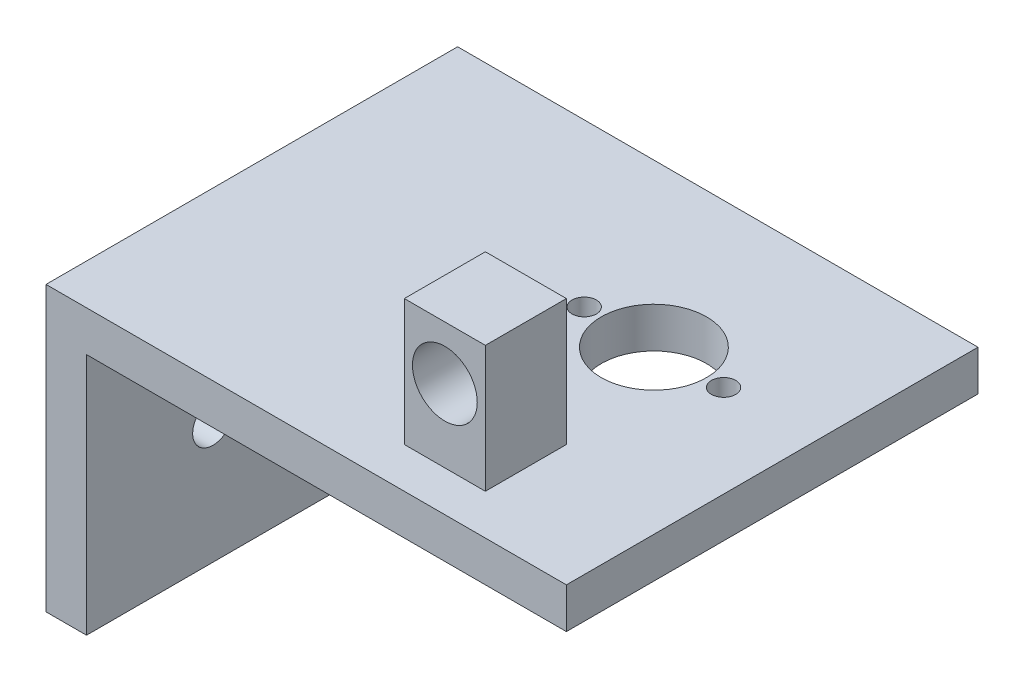
from build123d import *

# Parameters (mm, degrees)
SKETCH3_W           = 40
SKETCH3_H           = 50.8
BOSS_EXTRUDE1_DEPTH = 5
SKETCH4_W           = 10
SKETCH4_H           = 10
BOSS_EXTRUDE2_DEPTH = 15.6
SKETCH5_R           = 4
CUT_EXTRUDE4_DEPTH  = 8
SKETCH6_W           = 50.8
SKETCH6_H           = 5
BOSS_EXTRUDE3_DEPTH = 24.225
SKETCH8_W           = 5
SKETCH8_H           = 50.8
BOSS_EXTRUDE4_DEPTH = 30
SKETCH9_R           = 2.5
CUT_EXTRUDE5_DEPTH  = 5
SKETCH10_R          = 6.5
SKETCH10_R_2        = 1.5
CUT_EXTRUDE6_DEPTH  = 5


with BuildPart() as part:
    # Sketch3 → Boss-Extrude1 (new body)
    with BuildSketch(Plane(origin=(0, 0, 0), x_dir=(1, 0, 0), z_dir=(0, 1, 0))):
        with Locations((0, -5.4)):
            Rectangle(SKETCH3_W, SKETCH3_H)
    extrude(amount=BOSS_EXTRUDE1_DEPTH)

    # Sketch4 → Boss-Extrude2 (add)
    with BuildSketch(Plane(origin=(0, 5, 0), x_dir=(1, 0, 0), z_dir=(0, 1, 0))):
        with Locations((0, -20.8)):
            Rectangle(SKETCH4_W, SKETCH4_H)
    extrude(amount=BOSS_EXTRUDE2_DEPTH)

    # Sketch5 → Cut-Extrude4 (cut)
    with BuildSketch(Plane.XY.offset(25.8)):
        with Locations((0, 14)):
            Circle(SKETCH5_R)
    extrude(amount=-CUT_EXTRUDE4_DEPTH, mode=Mode.SUBTRACT)

    # Sketch6 → Boss-Extrude3 (add)
    with BuildSketch(Plane.ZY.offset(20)):
        with Locations((5.4, 2.5)):
            Rectangle(SKETCH6_W, SKETCH6_H)
    extrude(amount=BOSS_EXTRUDE3_DEPTH)

    # Sketch8 → Boss-Extrude4 (add)
    with BuildSketch(Plane.XZ):
        with Locations((-41.725, 5.4)):
            Rectangle(SKETCH8_W, SKETCH8_H)
    extrude(amount=BOSS_EXTRUDE4_DEPTH)

    # Sketch9 → Cut-Extrude5 (cut)
    with BuildSketch(Plane.ZY.offset(44.225)):
        with Locations((-4.8, -15)):
            Circle(SKETCH9_R)
        with Locations((15.2, -15)):
            Circle(SKETCH9_R)
    extrude(amount=-CUT_EXTRUDE5_DEPTH, mode=Mode.SUBTRACT)

    # Sketch10 → Cut-Extrude6 (cut)
    with BuildSketch(Plane(origin=(0, 5, 0), x_dir=(1, 0, 0), z_dir=(0, 1, 0))):
        with Locations(Location((0, 0, 0), (0, 0, 270))):
            Circle(SKETCH10_R)
        with Locations(Location((-8.6, 0, 0), (0, 0, 270))):
            Circle(SKETCH10_R_2)
        with Locations(Location((8.6, 0, 0), (0, 0, 270))):
            Circle(SKETCH10_R_2)
    extrude(amount=-CUT_EXTRUDE6_DEPTH, mode=Mode.SUBTRACT)


solid = part.part
